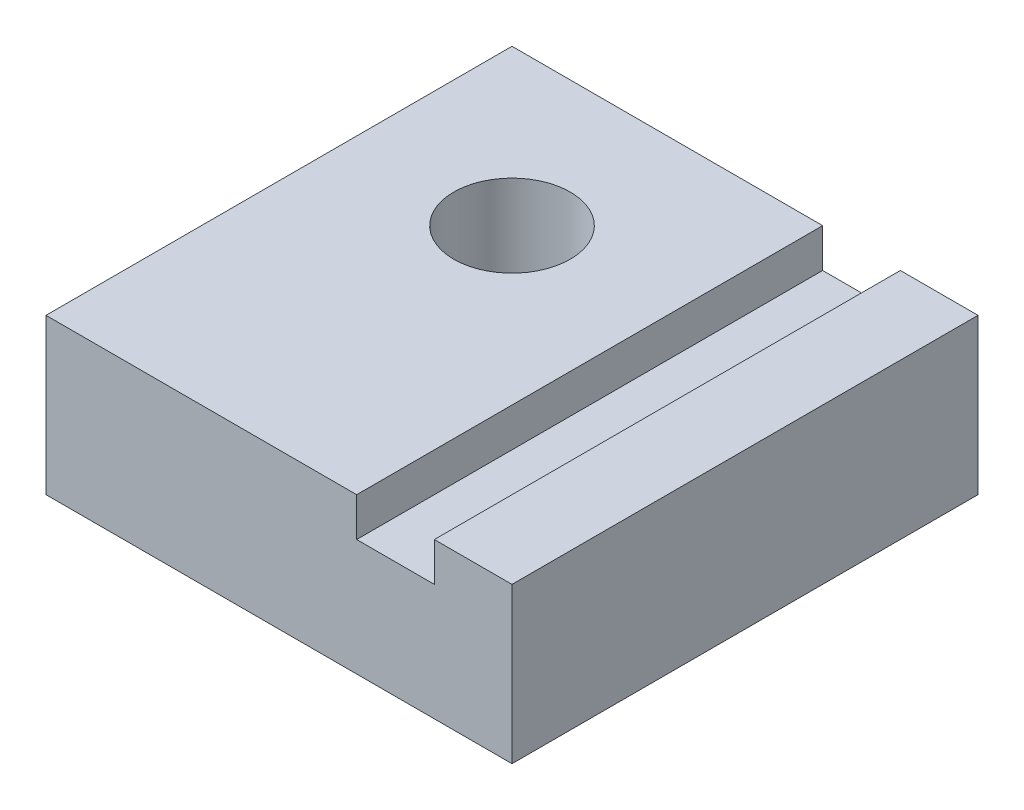
from build123d import *

# Parameters (mm, degrees)
BOSS_EXTRUDE1_DEPTH = 76.2
SKETCH2_R           = 9.525
CUT_EXTRUDE1_DEPTH  = 99.578509321


with BuildPart() as part:
    # Sketch1 → Boss-Extrude1 (new body)
    with BuildSketch(Plane.XY):
        Polygon((-57.15, 0), (19.05, 0), (19.05, 25.4), (6.35, 25.4), (6.35, 19.05), (-6.35, 19.05), (-6.35, 25.4), (-57.15, 25.4), align=None)
    extrude(amount=BOSS_EXTRUDE1_DEPTH)

    # Sketch2 → Cut-Extrude1 (cut, through all)
    with BuildSketch(Plane(origin=(0, 25.4, 0), x_dir=(1, 0, 0), z_dir=(0, 1, 0))):
        with Locations(Location((-31.75, -25.4, 0), (0, 0, 270))):
            Circle(SKETCH2_R)
    extrude(amount=-CUT_EXTRUDE1_DEPTH, mode=Mode.SUBTRACT)


solid = part.part
